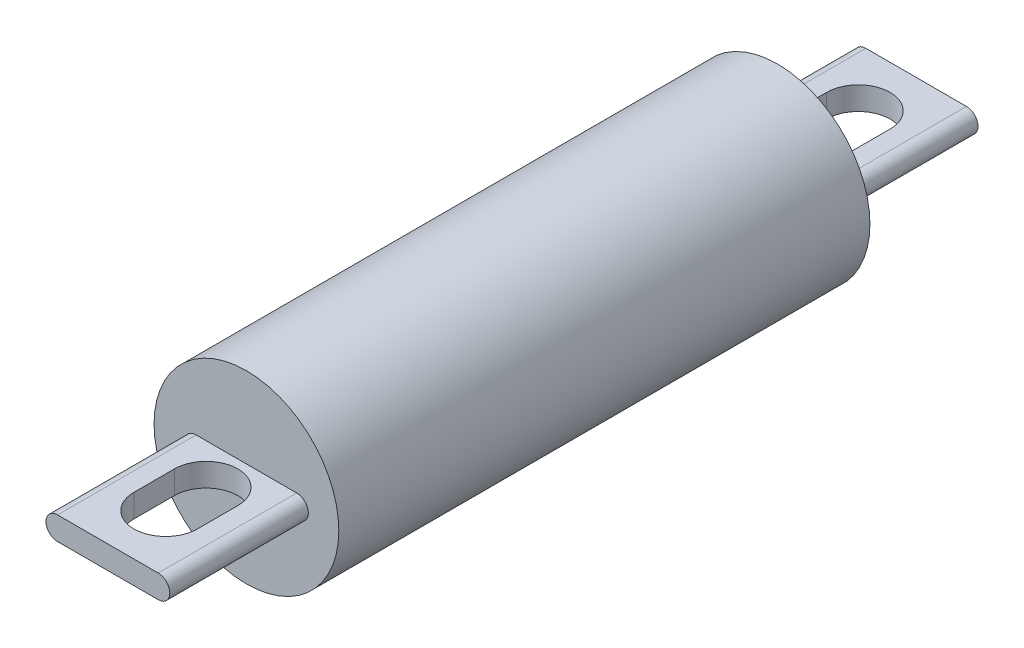
from build123d import *

# Parameters (mm, degrees)
SKETCH1_R           = 12.7
BOSS_EXTRUDE1_DEPTH = 36.515
SKETCH2_W           = 17.02
SKETCH2_H           = 19.05
BOSS_EXTRUDE2_DEPTH = 1.59
FILLET1_RADIUS      = 1.59
FILLET1_LENGTH      = 19.05
FILLET2_RADIUS      = 1.59
FILLET2_LENGTH      = 19.05
FILLET3_RADIUS      = 1.59
FILLET3_LENGTH      = 19.05
FILLET4_RADIUS      = 1.59
FILLET4_LENGTH      = 19.05


with BuildPart() as part:
    # Sketch1 → Boss-Extrude1 (new, symmetric)
    with BuildSketch(Plane.XY):
        Circle(SKETCH1_R)
    extrude(amount=BOSS_EXTRUDE1_DEPTH, both=True)

    # Sketch2 → Boss-Extrude2 (add, symmetric)
    # profile 1 of 2: a face of its own
    with BuildSketch(Plane(origin=(0, 0, 0), x_dir=(1, 0, 0), z_dir=(0, 1, 0))):
        with Locations((0, 46.04)):
            Rectangle(SKETCH2_W, SKETCH2_H)
        with BuildLine():
            Line((-4.365, 42.06), (-4.365, 47.62))
            ThreePointArc((-4.365, 47.62), (0, 51.985), (4.365, 47.62))
            Line((4.365, 47.62), (4.365, 42.06))
            ThreePointArc((4.365, 42.06), (0, 37.695), (-4.365, 42.06))
        make_face(mode=Mode.SUBTRACT)
    # profile 2 of 2: a face of its own
    with BuildSketch(Plane(origin=(0, 0, 0), x_dir=(1, 0, 0), z_dir=(0, 1, 0))):
        with Locations((0, -46.04)):
            Rectangle(SKETCH2_W, SKETCH2_H)
        with BuildLine():
            Line((4.365, -42.06), (4.365, -47.62))
            ThreePointArc((4.365, -47.62), (0, -51.985), (-4.365, -47.62))
            Line((-4.365, -47.62), (-4.365, -42.06))
            ThreePointArc((-4.365, -42.06), (0, -37.695), (4.365, -42.06))
        make_face(mode=Mode.SUBTRACT)
    extrude(amount=BOSS_EXTRUDE2_DEPTH, both=True)

    # Fillet1: full round fillet: the end face becomes a half cylinder, R = half its width
    fillet1_face = Plane((-8.51, 0, -46.04), x_dir=(0, 0, 1), z_dir=(-1, 0, 0))  # on the end face: x along it, z out of the body
    fillet1_slab = fillet1_face.offset(-FILLET1_RADIUS / 2) * Box(FILLET1_LENGTH, 2 * FILLET1_RADIUS, FILLET1_RADIUS, mode=Mode.PRIVATE)  # the body's end, R deep
    fillet1_round = Plane((-6.92, 0, -46.04), x_dir=(-1, 0, 0), z_dir=(0, 0, 1)) * Cylinder(FILLET1_RADIUS, FILLET1_LENGTH, mode=Mode.PRIVATE)  # its axis R under the face
    add(fillet1_slab - fillet1_round, mode=Mode.SUBTRACT)

    # Fillet2: full round fillet: the end face becomes a half cylinder, R = half its width
    fillet2_face = Plane((8.51, 0, -46.04), x_dir=(0, 0, -1), z_dir=(1, 0, 0))  # on the end face: x along it, z out of the body
    fillet2_slab = fillet2_face.offset(-FILLET2_RADIUS / 2) * Box(FILLET2_LENGTH, 2 * FILLET2_RADIUS, FILLET2_RADIUS, mode=Mode.PRIVATE)  # the body's end, R deep
    fillet2_round = Plane((6.92, 0, -46.04), x_dir=(1, 0, 0), z_dir=(0, 0, -1)) * Cylinder(FILLET2_RADIUS, FILLET2_LENGTH, mode=Mode.PRIVATE)  # its axis R under the face
    add(fillet2_slab - fillet2_round, mode=Mode.SUBTRACT)

    # Fillet3: full round fillet: the end face becomes a half cylinder, R = half its width
    fillet3_face = Plane((8.51, 0, 46.04), x_dir=(0, 0, 1), z_dir=(1, 0, 0))  # on the end face: x along it, z out of the body
    fillet3_slab = fillet3_face.offset(-FILLET3_RADIUS / 2) * Box(FILLET3_LENGTH, 2 * FILLET3_RADIUS, FILLET3_RADIUS, mode=Mode.PRIVATE)  # the body's end, R deep
    fillet3_round = Plane((6.92, 0, 46.04), x_dir=(1, 0, 0), z_dir=(0, 0, 1)) * Cylinder(FILLET3_RADIUS, FILLET3_LENGTH, mode=Mode.PRIVATE)  # its axis R under the face
    add(fillet3_slab - fillet3_round, mode=Mode.SUBTRACT)

    # Fillet4: full round fillet: the end face becomes a half cylinder, R = half its width
    fillet4_face = Plane((-8.51, 0, 46.04), x_dir=(0, 0, -1), z_dir=(-1, 0, 0))  # on the end face: x along it, z out of the body
    fillet4_slab = fillet4_face.offset(-FILLET4_RADIUS / 2) * Box(FILLET4_LENGTH, 2 * FILLET4_RADIUS, FILLET4_RADIUS, mode=Mode.PRIVATE)  # the body's end, R deep
    fillet4_round = Plane((-6.92, 0, 46.04), x_dir=(-1, 0, 0), z_dir=(0, 0, -1)) * Cylinder(FILLET4_RADIUS, FILLET4_LENGTH, mode=Mode.PRIVATE)  # its axis R under the face
    add(fillet4_slab - fillet4_round, mode=Mode.SUBTRACT)


solid = part.part
